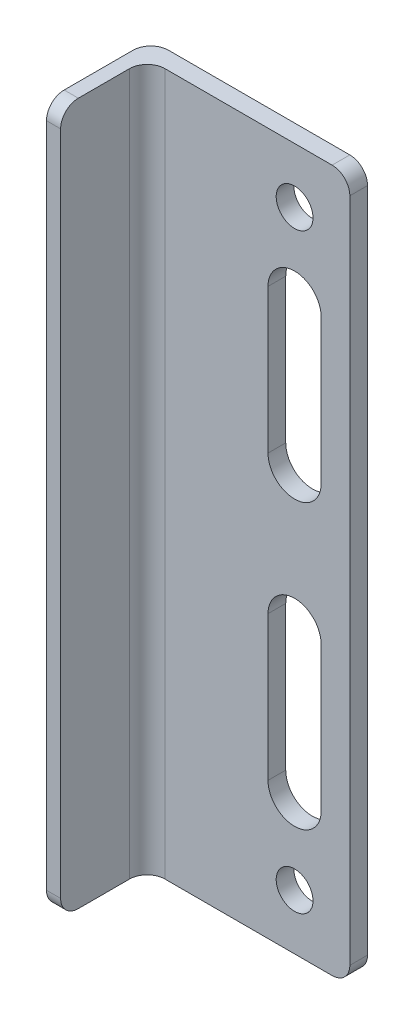
from build123d import *

# Parameters (mm, degrees)
SKETCH1_W               = 19.800000024
SKETCH1_H               = 125.800000114
SKETCH1_R               = 3.3
SKETCH1_W_2             = 19.05
BOSS_EXTRUDE1_DEPTH     = 3.175
CUT_EXTRUDE1_DEPTH      = 70.315172458
CUT_EXTRUDE1_DEPTH_BACK = 70.315172458
FILLET1_R               = 3.175
SKETCH7_W               = 2.54
SKETCH7_H               = 125.800000114
EXTRUDE_THIN1_DEPTH     = 15.525155132
FILLET2_R               = 3.175


with BuildPart() as part:
    # Sketch1 → Boss-Extrude1 (new body)
    # profile 1 of 2: a face of its own
    with BuildSketch(Plane.XY):
        Rectangle(SKETCH1_W, SKETCH1_H)
        with Locations((0, -53.000000045)):
            Circle(SKETCH1_R, mode=Mode.SUBTRACT)
        with Locations((0, 53.000000045)):
            Circle(SKETCH1_R, mode=Mode.SUBTRACT)
    # profile 2 of 2: a face of its own
    with BuildSketch(Plane.XY):
        with Locations((-19.425000012, 0)):
            Rectangle(SKETCH1_W_2, SKETCH1_H)
    extrude(amount=BOSS_EXTRUDE1_DEPTH)

    # Sketch6 → Cut-Extrude1 (cut, two sides: drawn at the far end of the back side and taken through both)
    with BuildSketch(Plane.XY.offset(3.175).offset(-CUT_EXTRUDE1_DEPTH_BACK)):
        with BuildLine():
            Line((4.7625, 38.337500033), (4.7625, 12.462499967))
            ThreePointArc((4.7625, 12.462499967), (0, 7.699999967), (-4.7625, 12.462499967))
            Line((-4.7625, 12.462499967), (-4.7625, 38.337500033))
            ThreePointArc((-4.7625, 38.337500033), (0, 43.100000033), (4.7625, 38.337500033))
        make_face()
        with BuildLine():
            Line((4.7625, -12.462499967), (4.7625, -38.337500033))
            ThreePointArc((4.7625, -38.337500033), (0, -43.100000033), (-4.7625, -38.337500033))
            Line((-4.7625, -38.337500033), (-4.7625, -12.462499967))
            ThreePointArc((-4.7625, -12.462499967), (0, -7.699999967), (4.7625, -12.462499967))
        make_face()
    extrude(amount=CUT_EXTRUDE1_DEPTH + CUT_EXTRUDE1_DEPTH_BACK, mode=Mode.SUBTRACT)

    # Fillet1
    fillet1_edges = [part.edges().sort_by_distance(p)[0] for p in [
        (9.900000012, 62.900000057, 1.5875),
        (9.900000012, -62.900000057, 1.5875),
    ]]
    fillet(fillet1_edges, radius=FILLET1_R)

    # Sketch7 → Extrude-Thin1 (add)
    with BuildSketch(Plane.XY.offset(3.175)):
        with Locations((-27.680000012, 0)):
            Rectangle(SKETCH7_W, SKETCH7_H)
    extrude(amount=EXTRUDE_THIN1_DEPTH)

    # Fillet2
    fillet2_edges = [part.edges().sort_by_distance(p)[0] for p in [
        (-27.680000012, -62.900000057, 18.700155132),
        (-27.680000012, 62.900000057, 18.700155132),
        (-26.410000012, 0, 3.175),
        (-28.950000012, 0, 0),
    ]]
    fillet(fillet2_edges, radius=FILLET2_R)


solid = part.part
